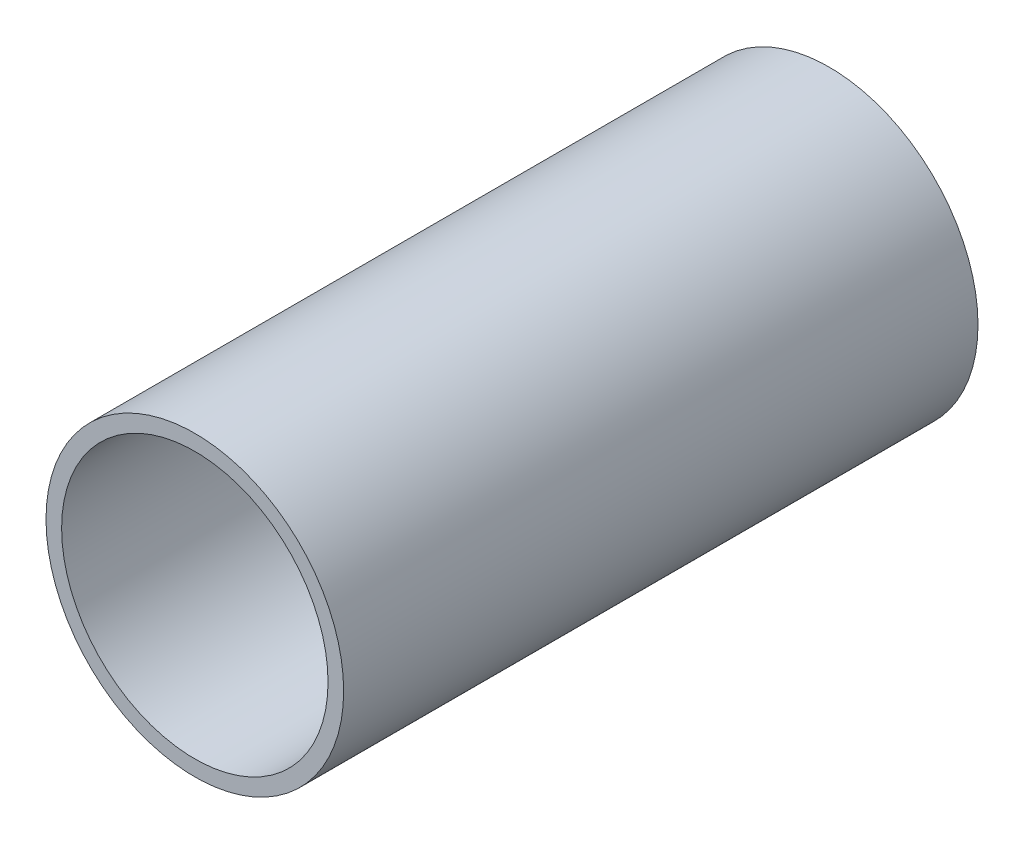
from build123d import *

# Parameters (mm, degrees)
SKETCH1_R           = 15.25
SKETCH1_R_2         = 13.65
BOSS_EXTRUDE1_DEPTH = 65


with BuildPart() as part:
    # Sketch1 → Boss-Extrude1 (new body)
    with BuildSketch(Plane.XY):
        Circle(SKETCH1_R)
        Circle(SKETCH1_R_2, mode=Mode.SUBTRACT)
    extrude(amount=BOSS_EXTRUDE1_DEPTH)


solid = part.part
